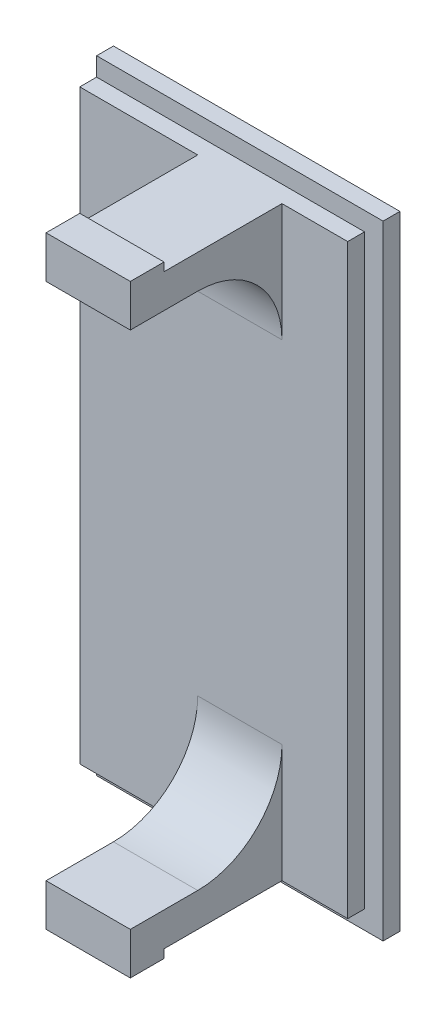
from build123d import *

# Parameters (mm, degrees)
ESQUISSE1_W        = 34
ESQUISSE1_H        = 74
BOSS_EXTRU_1_DEPTH = 2
ESQUISSE2_W        = 31.8
ESQUISSE2_H        = 69.6
BOSS_EXTRU_2_DEPTH = 2
ESQUISSE7_W        = 10
ESQUISSE7_H        = 4
BOSS_EXTRU_5_DEPTH = 18
ESQUISSE8_W        = 10
ESQUISSE8_H        = 1
BOSS_EXTRU_6_DEPTH = 4
CONG_2_R           = 10


with BuildPart() as part:
    # Esquisse1 → Boss.-Extru.1 (new body)
    with BuildSketch(Plane.XY):
        Rectangle(ESQUISSE1_W, ESQUISSE1_H)
    extrude(amount=BOSS_EXTRU_1_DEPTH)

    # Esquisse2 → Boss.-Extru.2 (add)
    with BuildSketch(Plane.XY.offset(2)):
        with Locations((-1.1, 0)):
            Rectangle(ESQUISSE2_W, ESQUISSE2_H)
    extrude(amount=BOSS_EXTRU_2_DEPTH)

    # Esquisse7 → Boss.-Extru.5 (add)
    with BuildSketch(Plane.XY.offset(4)):
        with Locations((2, 32.8)):
            Rectangle(ESQUISSE7_W, ESQUISSE7_H)
        with Locations((2, -32.8)):
            Rectangle(ESQUISSE7_W, ESQUISSE7_H)
    extrude(amount=BOSS_EXTRU_5_DEPTH)

    # Esquisse8 → Boss.-Extru.6 (add)
    with BuildSketch(Plane.XY.offset(22)):
        with Locations((2, 35.3)):
            Rectangle(ESQUISSE8_W, ESQUISSE8_H)
        with Locations((2, -35.3)):
            Rectangle(ESQUISSE8_W, ESQUISSE8_H)
    extrude(amount=-BOSS_EXTRU_6_DEPTH)

    # Congé2
    cong_2_edges = [part.edges().sort_by_distance(p)[0] for p in [
        (2, 30.8, 4),
        (2, -30.8, 4),
    ]]
    fillet(cong_2_edges, radius=CONG_2_R)


solid = part.part
